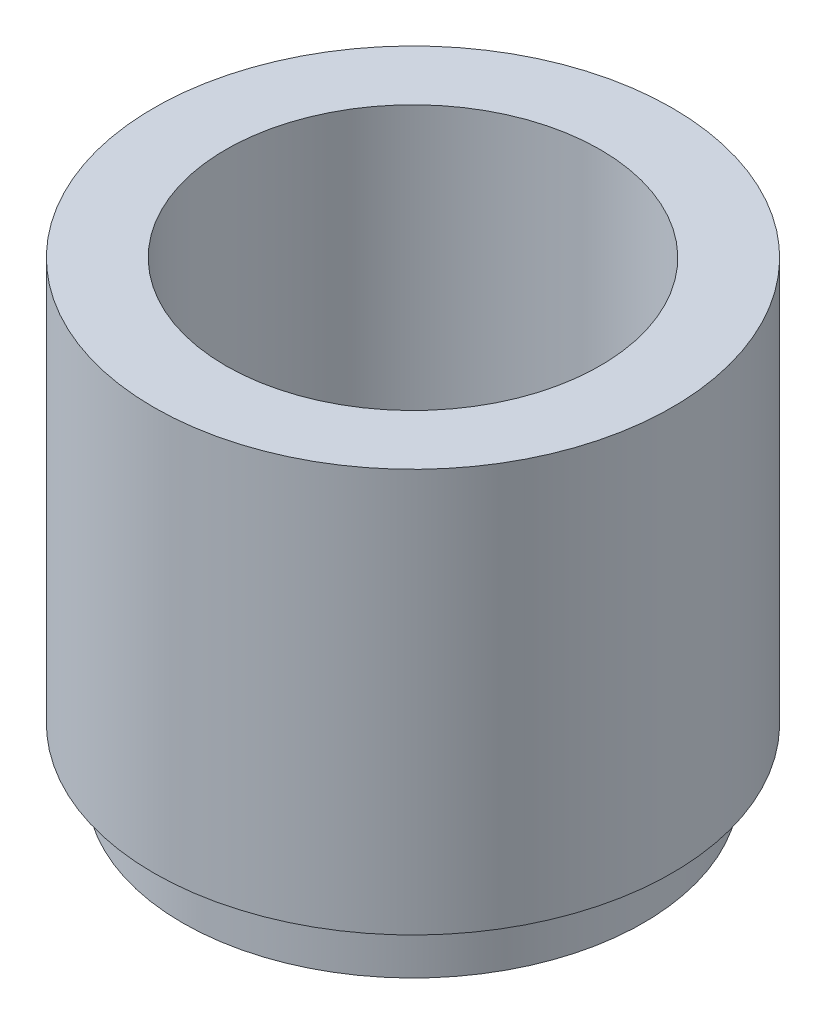
from build123d import *

# Parameters (mm, degrees)
SKETCH1_R           = 45
BOSS_EXTRUDE1_DEPTH = 80
SKETCH2_R           = 45
SKETCH2_R_2         = 40
CUT_EXTRUDE3_DEPTH  = 10
SKETCH3_R           = 32.5
CUT_EXTRUDE4_DEPTH  = 103.225241501


with BuildPart() as part:
    # Sketch1 → Boss-Extrude1 (new body)
    with BuildSketch(Plane(origin=(0, 0, 0), x_dir=(1, 0, 0), z_dir=(0, 1, 0))):
        with Locations(Location((0, 0, 0), (0, 0, 270))):
            Circle(SKETCH1_R)
    extrude(amount=BOSS_EXTRUDE1_DEPTH)

    # Sketch2 → Cut-Extrude3 (cut)
    with BuildSketch(Plane.XZ):
        with Locations(Location((0, 0, 0), (0, 0, 270))):
            Circle(SKETCH2_R)
        with Locations(Location((0, 0, 0), (0, 0, 270))):
            Circle(SKETCH2_R_2, mode=Mode.SUBTRACT)
    extrude(amount=-CUT_EXTRUDE3_DEPTH, mode=Mode.SUBTRACT)

    # Sketch3 → Cut-Extrude4 (cut, through all)
    with BuildSketch(Plane.XZ):
        with Locations(Location((0, 0, 0), (0, 0, 270))):
            Circle(SKETCH3_R)
    extrude(amount=-CUT_EXTRUDE4_DEPTH, mode=Mode.SUBTRACT)


solid = part.part
